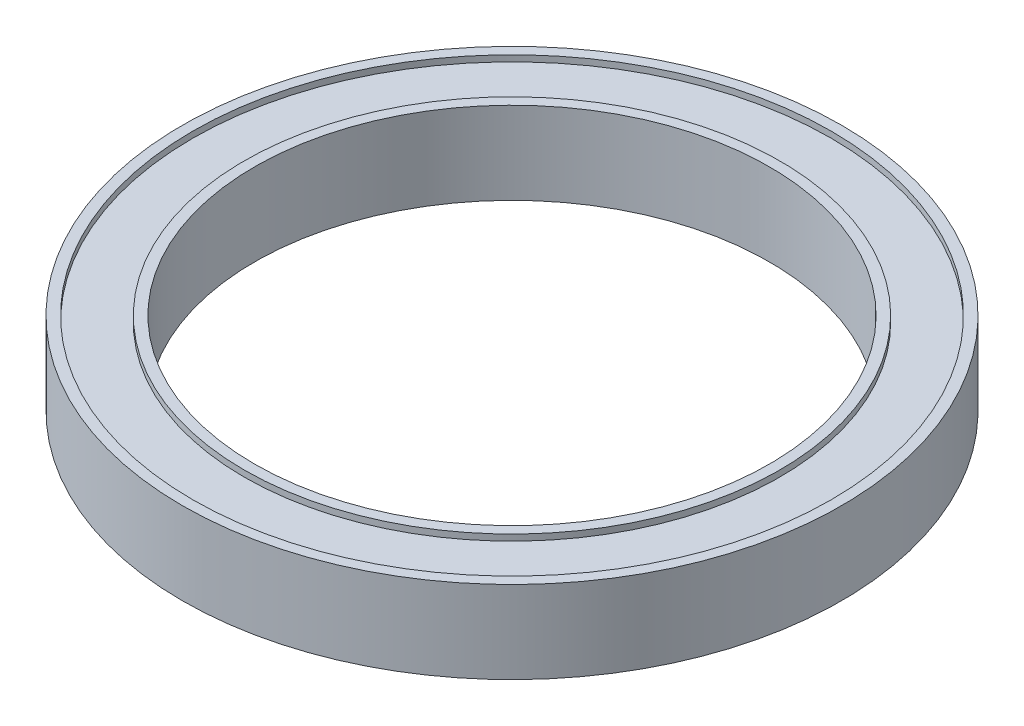
from build123d import *

# Parameters (mm, degrees)
SKETCH_1_R          = 16
SKETCH_1_R_2        = 12.5
EXTRUDE_1_DEPTH     = 4
SKETCH_2_R          = 15.5
SKETCH_2_R_2        = 13
CUT_EXTRUDE_1_DEPTH = 0.3


with BuildPart() as part:
    # 草图1 → 凸台-拉伸1 (new body)
    with BuildSketch(Plane(origin=(0, 0, 0), x_dir=(1, 0, 0), z_dir=(0, 1, 0))):
        with Locations(Location((0, 0, 0), (0, 0, 270))):
            Circle(SKETCH_1_R)
        with Locations(Location((0, 0, 0), (0, 0, 270))):
            Circle(SKETCH_1_R_2, mode=Mode.SUBTRACT)
    extrude(amount=EXTRUDE_1_DEPTH)

    # 草图2 → 切除-拉伸1 (cut)
    with BuildSketch(Plane(origin=(0, 4, 0), x_dir=(1, 0, 0), z_dir=(0, 1, 0))):
        with Locations(Location((0, 0, 0), (0, 0, 270))):
            Circle(SKETCH_2_R)
        with Locations(Location((0, 0, 0), (0, 0, 270))):
            Circle(SKETCH_2_R_2, mode=Mode.SUBTRACT)
    cut_extrude_1 = extrude(amount=-CUT_EXTRUDE_1_DEPTH, mode=Mode.SUBTRACT)

    # 镜向1: 切除-拉伸1 across plane
    add(cut_extrude_1.mirror(Plane.ZX.offset(2)), mode=Mode.SUBTRACT)


solid = part.part
